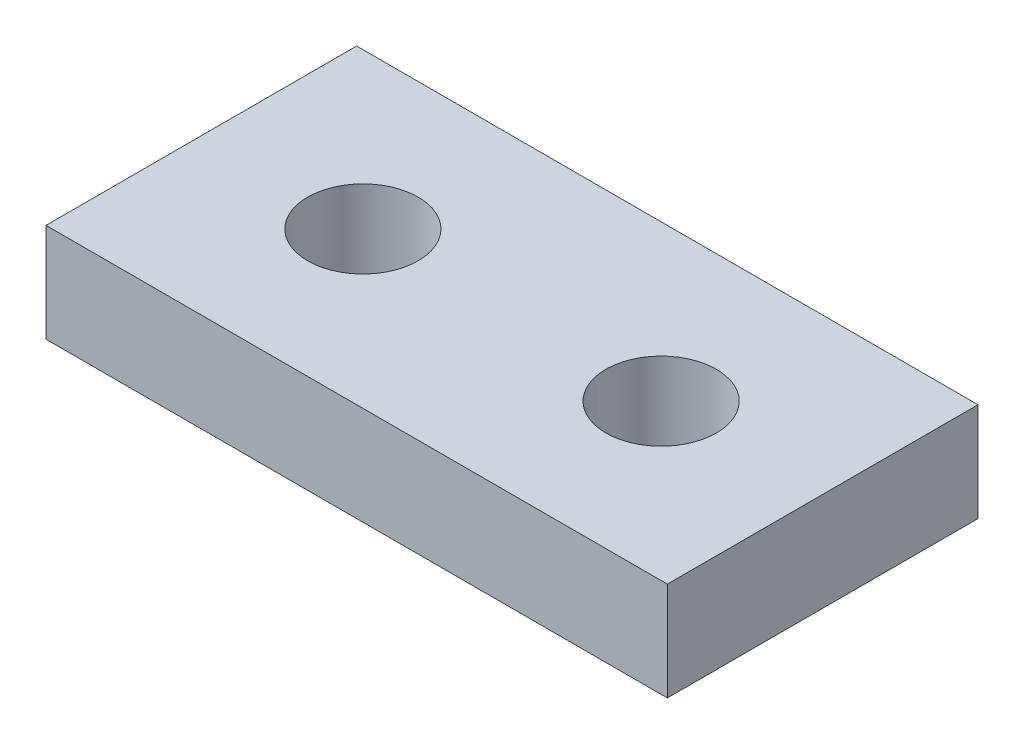
from build123d import *

# Parameters (mm, degrees)
SKETCH1_W                 = 10
SKETCH1_H                 = 5
BOSS_EXTRUDE1_DEPTH       = 1.5875
F_2_56_TAPPED_HOLE1_D     = 1.778
F_2_56_TAPPED_HOLE1_DEPTH = 5.73
F_2_56_TAPPED_HOLE1_TIP   = 0.53416509


with BuildPart() as part:
    # Sketch1 → Boss-Extrude1 (new body)
    with BuildSketch(Plane(origin=(0, 0, 0), x_dir=(1, 0, 0), z_dir=(0, 1, 0))):
        Rectangle(SKETCH1_W, SKETCH1_H)
    extrude(amount=BOSS_EXTRUDE1_DEPTH)

    # #2-56 Tapped Hole1
    with Locations(Plane(origin=(0, 1.5875, 0), x_dir=(1, 0, 0), z_dir=(0, 1, 0))):
        with Locations((-2.4, 0), (2.4, 0)):
            Hole(F_2_56_TAPPED_HOLE1_D / 2, depth=F_2_56_TAPPED_HOLE1_DEPTH)
            with Locations((0, 0, -(F_2_56_TAPPED_HOLE1_DEPTH + F_2_56_TAPPED_HOLE1_TIP / 2))):  # 118° drill point
                Cone(0, F_2_56_TAPPED_HOLE1_D / 2, F_2_56_TAPPED_HOLE1_TIP, mode=Mode.SUBTRACT)


solid = part.part
